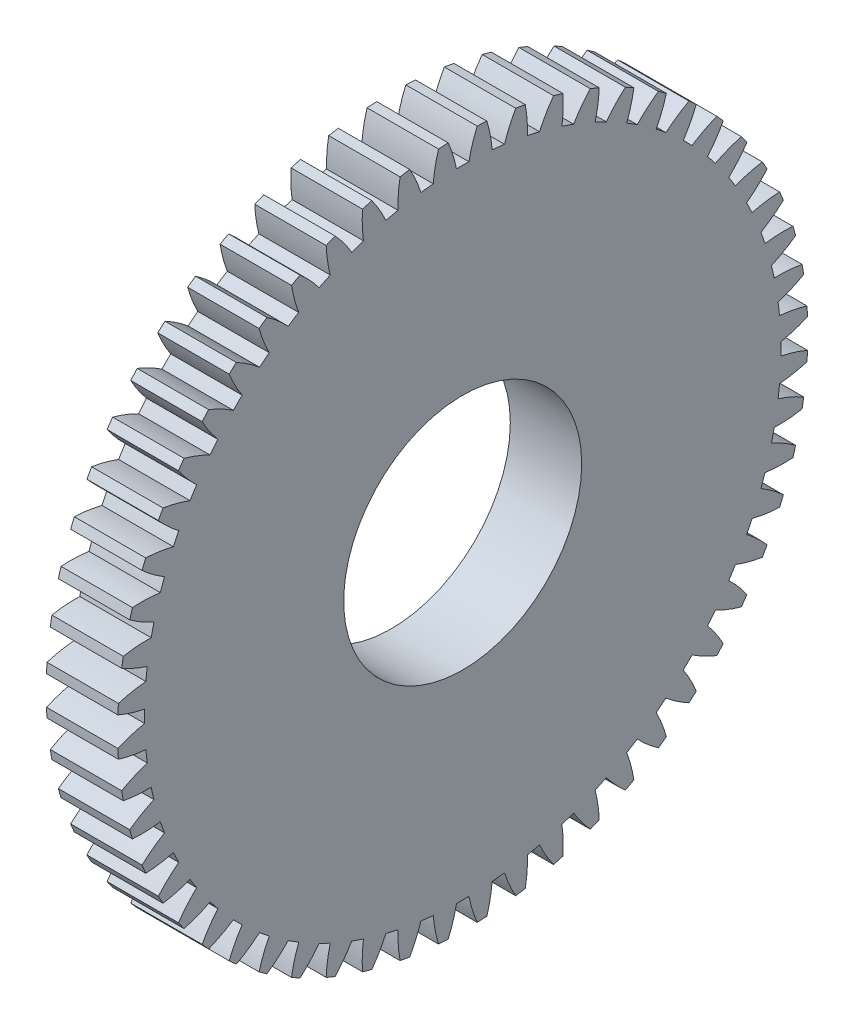
from build123d import *

# Parameters (mm, degrees)
BASPROSKE_W        = 4.7625
BASPROSKE_H        = 23.01875
TOOTHCUT_DEPTH     = 33.899956069
TEETHCUTS_COUNT    = 56
TEETHCUTS_ANGLE    = 353.571428571
BORSKE_R           = 3.175
BORE_DEPTH         = 11.112754
SKETCH1_R          = 7.9375
CUT_EXTRUDE1_DEPTH = 33.871486758


with BuildPart() as part:
    # BasProSke → Base-Revolve (revolve)
    with BuildSketch(Plane(origin=(0, 0, 0), x_dir=(1, 0, 0), z_dir=(0, 1, 0)), mode=Mode.PRIVATE) as base_revolve_sk:
        with Locations((2.38125, 11.509375)):
            Rectangle(BASPROSKE_W, BASPROSKE_H)
    revolve(base_revolve_sk.sketch.rotate(Axis((-10, 0, 0), (1, 0, 0)), 180), axis=Axis((-10, 0, 0), (1, 0, 0)))

    # TooCutSke → ToothCut (cut, through all)
    with BuildSketch(Plane(origin=(0, 0, 0), x_dir=(0, 0, -1), z_dir=(1, 0, 0))):
        with BuildLine():
            ThreePointArc((0.413818462, 21.217664932), (0, 21.2217), (-0.413818462, 21.217664932))
            ThreePointArc((-0.413818462, 21.217664932), (-0.647931168, 22.135579108), (-0.978386748, 23.023370922))
            ThreePointArc((-0.978386748, 23.023370922), (0, 23.04415), (0.978386748, 23.023370922))
            ThreePointArc((0.978386748, 23.023370922), (0.647931168, 22.135579108), (0.413818462, 21.217664932))
        make_face()
    toothcut = extrude(amount=TOOTHCUT_DEPTH, mode=Mode.SUBTRACT)

    # TeethCuts: ToothCut ×56 about axis
    teethcuts_axis = Axis((-10, 0, 0), (1, 0, 0))
    for i in range(1, TEETHCUTS_COUNT):
        add(toothcut.rotate(teethcuts_axis, i * TEETHCUTS_ANGLE / (TEETHCUTS_COUNT - 1)), mode=Mode.SUBTRACT)

    # BorSke → Bore (cut, symmetric)
    with BuildSketch(Plane(origin=(0, 0, 0), x_dir=(0, 0, -1), z_dir=(1, 0, 0))):
        with Locations(Location((0, 0, 0), (0, 0, 180))):
            Circle(BORSKE_R)
    extrude(amount=BORE_DEPTH, both=True, mode=Mode.SUBTRACT)

    # Sketch1 → Cut-Extrude1 (cut, through all)
    with BuildSketch(Plane(origin=(4.7625, 0, 0), x_dir=(0, 0, -1), z_dir=(1, 0, 0))):
        Circle(SKETCH1_R)
    extrude(amount=-CUT_EXTRUDE1_DEPTH, mode=Mode.SUBTRACT)


solid = part.part
